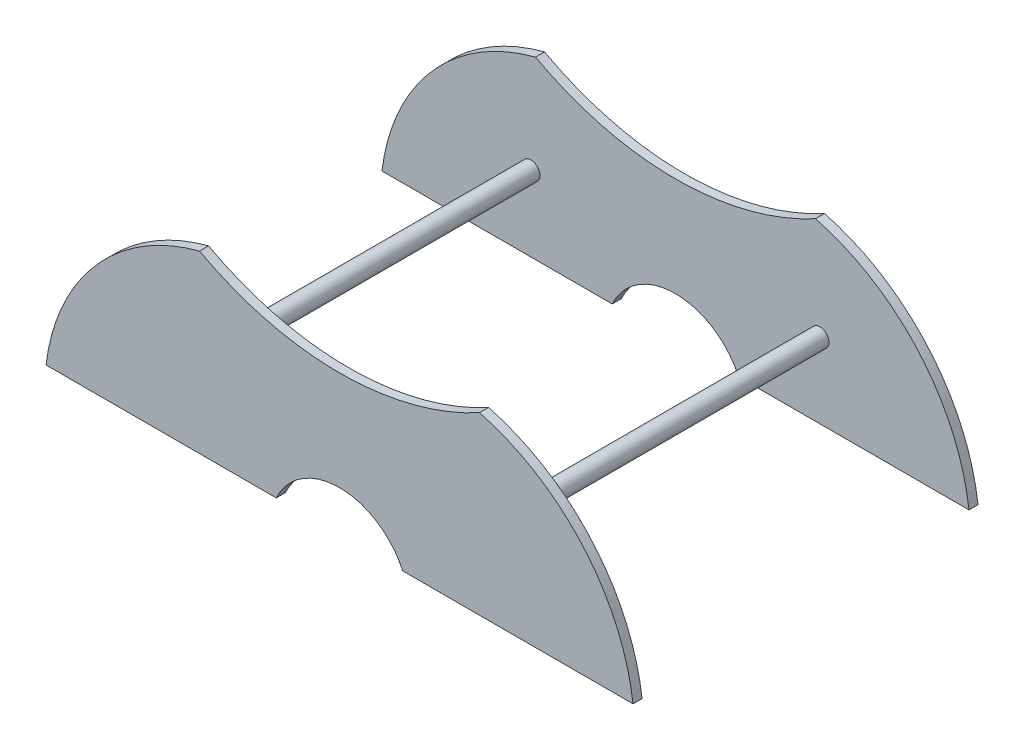
from build123d import *

# Parameters (mm, degrees)
BOSS_EXTRUDE1_DEPTH = 10
BOSS_EXTRUDE2_DEPTH = 10
SKETCH3_R           = 10
BOSS_EXTRUDE3_DEPTH = 382


with BuildPart() as part:
    # Sketch1 → Boss-Extrude1 (new body)
    with BuildSketch(Plane.XY):
        with BuildLine():
            Line((-325, 0), (-70, 0))
            ThreePointArc((-70, 0), (0, 44.921970135), (70, 0))
            Line((70, 0), (325, 0))
            ThreePointArc((325, 0), (269.81612239, 123.213044268), (155, 194.233975444))
            ThreePointArc((155, 194.233975444), (0, 154.921970135), (-155, 194.233975444))
            ThreePointArc((-155, 194.233975444), (-269.81612239, 123.213044268), (-325, 0))
        make_face()
    extrude(amount=BOSS_EXTRUDE1_DEPTH)



with BuildPart() as body_2:
    # Sketch2 → Boss-Extrude2 (new body)
    with BuildSketch(Plane.XY.offset(-362)):
        with BuildLine():
            Line((70, 0), (325, 0))
            ThreePointArc((325, 0), (269.81612239, 123.213044268), (155, 194.233975444))
            ThreePointArc((155, 194.233975444), (0, 154.921970135), (-155, 194.233975444))
            ThreePointArc((-155, 194.233975444), (-269.81612239, 123.213044268), (-325, 0))
            Line((-325, 0), (-70, 0))
            ThreePointArc((-70, 0), (0, 44.921970135), (70, 0))
        make_face()
    extrude(amount=-BOSS_EXTRUDE2_DEPTH)


with BuildPart() as part_1:
    add(part.part)

    add(body_2.part)  # Boss-Extrude3 merges body 2
    # Sketch3 → Boss-Extrude3 (add)
    with BuildSketch(Plane.XY.offset(10)):
        with Locations((-160, 83.10096245)):
            Circle(SKETCH3_R)
        with Locations((160, 83.10096245)):
            Circle(SKETCH3_R)
    extrude(amount=-BOSS_EXTRUDE3_DEPTH)


solid = part_1.part
